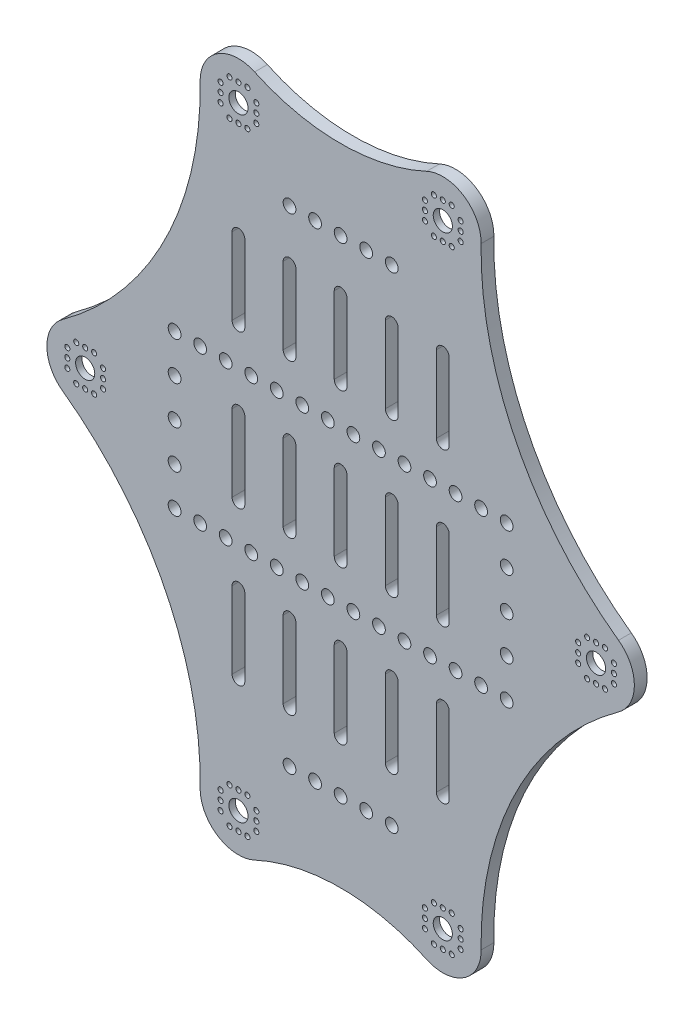
from build123d import *

# Parameters (mm, degrees)
BOSS_EXTRUDE1_DEPTH       = 5
SKETCH2_R                 = 11.25
CUT_EXTRUDE1_DEPTH        = 2.5
SKETCH3_R                 = 1
SKETCH3_R_2               = 3.75
CUT_EXTRUDE2_DEPTH        = 2.5
MIRROR2_COPY_1_SKETCH_R   = 1
MIRROR2_COPY_1_SKETCH_R_2 = 3.75
MIRROR2_COPY_1_DEPTH      = 2.5
SKETCH5_R                 = 2.5
CUT_EXTRUDE4_DEPTH        = 12.5
CUT_EXTRUDE6_DEPTH        = 10
SKETCH9_R                 = 2.5
CUT_EXTRUDE7_DEPTH        = 10
SKETCH10_R                = 2.5
CUT_EXTRUDE8_DEPTH        = 10


with BuildPart() as part:
    # Sketch1 → Boss-Extrude1 (new body)
    with BuildSketch(Plane.XY):
        with BuildLine():
            ThreePointArc((108.79085436, -12.15404787), (115, 0), (108.79085436, 12.15404787))
            ThreePointArc((108.79085436, 12.15404787), (68.702723984, 59.351361992), (54.997750912, 119.740254766))
            ThreePointArc((54.997750912, 119.740254766), (48.179588548, 132.573556823), (33.684210526, 133.60554311))
            ThreePointArc((33.684210526, 133.60554311), (0, 126.168439698), (-33.684210526, 133.60554311))
            ThreePointArc((-33.684210526, 133.60554311), (-48.179588548, 132.573556823), (-54.997750912, 119.740254766))
            ThreePointArc((-54.997750912, 119.740254766), (-68.702723984, 59.351361992), (-108.79085436, 12.15404787))
            ThreePointArc((-108.79085436, 12.15404787), (-115, 0), (-108.79085436, -12.15404787))
            ThreePointArc((-108.79085436, -12.15404787), (-68.702723984, -59.351361992), (-54.997750912, -119.740254766))
            ThreePointArc((-54.997750912, -119.740254766), (-48.179588548, -132.573556823), (-33.684210526, -133.60554311))
            ThreePointArc((-33.684210526, -133.60554311), (0, -126.168439698), (33.684210526, -133.60554311))
            ThreePointArc((33.684210526, -133.60554311), (48.179588548, -132.573556823), (54.997750912, -119.740254766))
            ThreePointArc((54.997750912, -119.740254766), (68.702723984, -59.351361992), (108.79085436, -12.15404787))
        make_face()
    extrude(amount=BOSS_EXTRUDE1_DEPTH)

    # Sketch2 → Cut-Extrude1 (cut)
    with BuildSketch(Plane(origin=(0, 0, 0), x_dir=(-1, 0, 0), z_dir=(0, 0, -1))):
        with Locations((-40, 120)):
            Circle(SKETCH2_R)
        with Locations((-100, 0)):
            Circle(SKETCH2_R)
        with Locations((100, 0)):
            Circle(SKETCH2_R)
        with Locations((40, 120)):
            Circle(SKETCH2_R)
        with Locations((40, -120)):
            Circle(SKETCH2_R)
        with Locations((-40, -120)):
            Circle(SKETCH2_R)
    extrude(amount=-CUT_EXTRUDE1_DEPTH, mode=Mode.SUBTRACT)

    # Sketch3 → Cut-Extrude2 (cut)
    with BuildSketch(Plane(origin=(0, 0, 2.5), x_dir=(-1, 0, 0), z_dir=(0, 0, -1))):
        with Locations((-47, 123.5)):
            Circle(SKETCH3_R)
        with Locations((-47, 120)):
            Circle(SKETCH3_R)
        with Locations((-47, 116.5)):
            Circle(SKETCH3_R)
        with Locations((-40, 120)):
            Circle(SKETCH3_R_2)
        with Locations((-43.5, 113)):
            Circle(SKETCH3_R)
        with Locations((-40, 113)):
            Circle(SKETCH3_R)
        with Locations((-36.5, 113)):
            Circle(SKETCH3_R)
        with Locations((-33, 116.5)):
            Circle(SKETCH3_R)
        with Locations((-33, 120)):
            Circle(SKETCH3_R)
        with Locations((-33, 123.5)):
            Circle(SKETCH3_R)
        with Locations((-36.5, 127)):
            Circle(SKETCH3_R)
        with Locations((-40, 127)):
            Circle(SKETCH3_R)
        with Locations((-43.5, 127)):
            Circle(SKETCH3_R)
        with Locations((-100, -7)):
            Circle(SKETCH3_R)
        with Locations((-100, 0)):
            Circle(SKETCH3_R_2)
        with Locations((-93, 0)):
            Circle(SKETCH3_R)
        with Locations((-100, 0)):
            Circle(SKETCH3_R_2)
        with Locations((-100, 0)):
            Circle(SKETCH3_R_2)
        with Locations((-107, -3.5)):
            Circle(SKETCH3_R)
        with Locations((-107, 0)):
            Circle(SKETCH3_R)
        with Locations((-107, 3.5)):
            Circle(SKETCH3_R)
        with Locations((-103.5, 7)):
            Circle(SKETCH3_R)
        with Locations((-100, 7)):
            Circle(SKETCH3_R)
        with Locations((-96.5, 7)):
            Circle(SKETCH3_R)
        with Locations((-96.5, -7)):
            Circle(SKETCH3_R)
        with Locations((-103.5, -7)):
            Circle(SKETCH3_R)
        with Locations((-93, -3.5)):
            Circle(SKETCH3_R)
        with Locations((-93, 3.5)):
            Circle(SKETCH3_R)
    cut_extrude2 = extrude(amount=-CUT_EXTRUDE2_DEPTH, mode=Mode.SUBTRACT)

    # Mirror1: Cut-Extrude2 across plane
    add(cut_extrude2.mirror(Plane(origin=(0, 0, 0), x_dir=(0, 0, 1), z_dir=(1, 0, 0))), mode=Mode.SUBTRACT)

    # Mirror2: Cut-Extrude2 across plane
    add(cut_extrude2.mirror(Plane.ZX), mode=Mode.SUBTRACT)

    # Mirror2 copy 1 sketch → Mirror2 copy 1 (cut)
    with BuildSketch(Plane(origin=(0, 0, 2.5), x_dir=(1, 0, 0), z_dir=(0, 0, -1))):
        with Locations((-47, 123.5)):
            Circle(MIRROR2_COPY_1_SKETCH_R)
        with Locations((-47, 120)):
            Circle(MIRROR2_COPY_1_SKETCH_R)
        with Locations((-47, 116.5)):
            Circle(MIRROR2_COPY_1_SKETCH_R)
        with Locations((-40, 120)):
            Circle(MIRROR2_COPY_1_SKETCH_R_2)
        with Locations((-43.5, 113)):
            Circle(MIRROR2_COPY_1_SKETCH_R)
        with Locations((-40, 113)):
            Circle(MIRROR2_COPY_1_SKETCH_R)
        with Locations((-36.5, 113)):
            Circle(MIRROR2_COPY_1_SKETCH_R)
        with Locations((-33, 116.5)):
            Circle(MIRROR2_COPY_1_SKETCH_R)
        with Locations((-33, 120)):
            Circle(MIRROR2_COPY_1_SKETCH_R)
        with Locations((-33, 123.5)):
            Circle(MIRROR2_COPY_1_SKETCH_R)
        with Locations((-36.5, 127)):
            Circle(MIRROR2_COPY_1_SKETCH_R)
        with Locations((-40, 127)):
            Circle(MIRROR2_COPY_1_SKETCH_R)
        with Locations((-43.5, 127)):
            Circle(MIRROR2_COPY_1_SKETCH_R)
        with Locations((-100, -7)):
            Circle(MIRROR2_COPY_1_SKETCH_R)
        with Locations((-100, 0)):
            Circle(MIRROR2_COPY_1_SKETCH_R_2)
        with Locations((-93, 0)):
            Circle(MIRROR2_COPY_1_SKETCH_R)
        with Locations((-100, 0)):
            Circle(MIRROR2_COPY_1_SKETCH_R_2)
        with Locations((-100, 0)):
            Circle(MIRROR2_COPY_1_SKETCH_R_2)
        with Locations((-107, -3.5)):
            Circle(MIRROR2_COPY_1_SKETCH_R)
        with Locations((-107, 0)):
            Circle(MIRROR2_COPY_1_SKETCH_R)
        with Locations((-107, 3.5)):
            Circle(MIRROR2_COPY_1_SKETCH_R)
        with Locations((-103.5, 7)):
            Circle(MIRROR2_COPY_1_SKETCH_R)
        with Locations((-100, 7)):
            Circle(MIRROR2_COPY_1_SKETCH_R)
        with Locations((-96.5, 7)):
            Circle(MIRROR2_COPY_1_SKETCH_R)
        with Locations((-96.5, -7)):
            Circle(MIRROR2_COPY_1_SKETCH_R)
        with Locations((-103.5, -7)):
            Circle(MIRROR2_COPY_1_SKETCH_R)
        with Locations((-93, -3.5)):
            Circle(MIRROR2_COPY_1_SKETCH_R)
        with Locations((-93, 3.5)):
            Circle(MIRROR2_COPY_1_SKETCH_R)
    extrude(amount=-MIRROR2_COPY_1_DEPTH, mode=Mode.SUBTRACT)

    # Sketch5 → Cut-Extrude4 (cut)
    with BuildSketch(Plane(origin=(0, 0, 0), x_dir=(-1, 0, 0), z_dir=(0, 0, -1))):
        with Locations((20, 95)):
            Circle(SKETCH5_R)
        with Locations((0, 95)):
            Circle(SKETCH5_R)
        with Locations((10, 95)):
            Circle(SKETCH5_R)
        with Locations((10, -95)):
            Circle(SKETCH5_R)
        with Locations((0, -95)):
            Circle(SKETCH5_R)
        with Locations((20, -95)):
            Circle(SKETCH5_R)
        with Locations((-20, 95)):
            Circle(SKETCH5_R)
        with Locations((-10, 95)):
            Circle(SKETCH5_R)
        with Locations((-20, -95)):
            Circle(SKETCH5_R)
        with Locations((-10, -95)):
            Circle(SKETCH5_R)
    extrude(amount=-CUT_EXTRUDE4_DEPTH, mode=Mode.SUBTRACT)

    # Sketch8 → Cut-Extrude6 (cut)
    with BuildSketch(Plane.XY.offset(5)):
        with BuildLine():
            Line((42.5, 75), (42.5, 45))
            ThreePointArc((42.5, 45), (40, 42.5), (37.5, 45))
            Line((37.5, 45), (37.5, 75))
            ThreePointArc((37.5, 75), (40, 77.5), (42.5, 75))
        make_face()
        with BuildLine():
            Line((22.5, 75), (22.5, 45))
            ThreePointArc((22.5, 45), (20, 42.5), (17.5, 45))
            Line((17.5, 45), (17.5, 75))
            ThreePointArc((17.5, 75), (20, 77.5), (22.5, 75))
        make_face()
        with BuildLine():
            Line((2.5, 75), (2.5, 45))
            ThreePointArc((2.5, 45), (0, 42.5), (-2.5, 45))
            Line((-2.5, 45), (-2.5, 75))
            ThreePointArc((-2.5, 75), (0, 77.5), (2.5, 75))
        make_face()
        with BuildLine():
            Line((-17.5, 75), (-17.5, 45))
            ThreePointArc((-17.5, 45), (-20, 42.5), (-22.5, 45))
            Line((-22.5, 45), (-22.5, 75))
            ThreePointArc((-22.5, 75), (-20, 77.5), (-17.5, 75))
        make_face()
        with BuildLine():
            Line((-37.5, 75), (-37.5, 45))
            ThreePointArc((-37.5, 45), (-40, 42.5), (-42.5, 45))
            Line((-42.5, 45), (-42.5, 75))
            ThreePointArc((-42.5, 75), (-40, 77.5), (-37.5, 75))
        make_face()
        with BuildLine():
            Line((42.5, 15), (42.5, -15))
            ThreePointArc((42.5, -15), (40, -17.5), (37.5, -15))
            Line((37.5, -15), (37.5, 15))
            ThreePointArc((37.5, 15), (40, 17.5), (42.5, 15))
        make_face()
        with BuildLine():
            Line((22.5, 15), (22.5, -15))
            ThreePointArc((22.5, -15), (20, -17.5), (17.5, -15))
            Line((17.5, -15), (17.5, 15))
            ThreePointArc((17.5, 15), (20, 17.5), (22.5, 15))
        make_face()
        with BuildLine():
            Line((2.5, 15), (2.5, -15))
            ThreePointArc((2.5, -15), (0, -17.5), (-2.5, -15))
            Line((-2.5, -15), (-2.5, 15))
            ThreePointArc((-2.5, 15), (0, 17.5), (2.5, 15))
        make_face()
        with BuildLine():
            Line((-17.5, 15), (-17.5, -15))
            ThreePointArc((-17.5, -15), (-20, -17.5), (-22.5, -15))
            Line((-22.5, -15), (-22.5, 15))
            ThreePointArc((-22.5, 15), (-20, 17.5), (-17.5, 15))
        make_face()
        with BuildLine():
            Line((-37.5, 15), (-37.5, -15))
            ThreePointArc((-37.5, -15), (-40, -17.5), (-42.5, -15))
            Line((-42.5, -15), (-42.5, 15))
            ThreePointArc((-42.5, 15), (-40, 17.5), (-37.5, 15))
        make_face()
        with BuildLine():
            Line((42.5, -45), (42.5, -75))
            ThreePointArc((42.5, -75), (40, -77.5), (37.5, -75))
            Line((37.5, -75), (37.5, -45))
            ThreePointArc((37.5, -45), (40, -42.5), (42.5, -45))
        make_face()
        with BuildLine():
            Line((22.5, -45), (22.5, -75))
            ThreePointArc((22.5, -75), (20, -77.5), (17.5, -75))
            Line((17.5, -75), (17.5, -45))
            ThreePointArc((17.5, -45), (20, -42.5), (22.5, -45))
        make_face()
        with BuildLine():
            Line((2.5, -45), (2.5, -75))
            ThreePointArc((2.5, -75), (0, -77.5), (-2.5, -75))
            Line((-2.5, -75), (-2.5, -45))
            ThreePointArc((-2.5, -45), (0, -42.5), (2.5, -45))
        make_face()
        with BuildLine():
            Line((-17.5, -45), (-17.5, -75))
            ThreePointArc((-17.5, -75), (-20, -77.5), (-22.5, -75))
            Line((-22.5, -75), (-22.5, -45))
            ThreePointArc((-22.5, -45), (-20, -42.5), (-17.5, -45))
        make_face()
        with BuildLine():
            Line((-37.5, -45), (-37.5, -75))
            ThreePointArc((-37.5, -75), (-40, -77.5), (-42.5, -75))
            Line((-42.5, -75), (-42.5, -45))
            ThreePointArc((-42.5, -45), (-40, -42.5), (-37.5, -45))
        make_face()
    extrude(amount=-CUT_EXTRUDE6_DEPTH, mode=Mode.SUBTRACT)

    # Sketch9 → Cut-Extrude7 (cut)
    with BuildSketch(Plane.XY.offset(5)):
        with Locations((-65, 30)):
            Circle(SKETCH9_R)
        with Locations((-55, 30)):
            Circle(SKETCH9_R)
        with Locations((-45, 30)):
            Circle(SKETCH9_R)
        with Locations((-35, 30)):
            Circle(SKETCH9_R)
        with Locations((-25, 30)):
            Circle(SKETCH9_R)
        with Locations((-15, 30)):
            Circle(SKETCH9_R)
        with Locations((-5, 30)):
            Circle(SKETCH9_R)
        with Locations((5, 30)):
            Circle(SKETCH9_R)
        with Locations((15, 30)):
            Circle(SKETCH9_R)
        with Locations((25, 30)):
            Circle(SKETCH9_R)
        with Locations((35, 30)):
            Circle(SKETCH9_R)
        with Locations((45, 30)):
            Circle(SKETCH9_R)
        with Locations((55, 30)):
            Circle(SKETCH9_R)
        with Locations((65, 30)):
            Circle(SKETCH9_R)
        with Locations((65, -30)):
            Circle(SKETCH9_R)
        with Locations((55, -30)):
            Circle(SKETCH9_R)
        with Locations((45, -30)):
            Circle(SKETCH9_R)
        with Locations((35, -30)):
            Circle(SKETCH9_R)
        with Locations((25, -30)):
            Circle(SKETCH9_R)
        with Locations((15, -30)):
            Circle(SKETCH9_R)
        with Locations((5, -30)):
            Circle(SKETCH9_R)
        with Locations((-5, -30)):
            Circle(SKETCH9_R)
        with Locations((-15, -30)):
            Circle(SKETCH9_R)
        with Locations((-25, -30)):
            Circle(SKETCH9_R)
        with Locations((-35, -30)):
            Circle(SKETCH9_R)
        with Locations((-45, -30)):
            Circle(SKETCH9_R)
        with Locations((-55, -30)):
            Circle(SKETCH9_R)
        with Locations((-65, -30)):
            Circle(SKETCH9_R)
    extrude(amount=-CUT_EXTRUDE7_DEPTH, mode=Mode.SUBTRACT)

    # Sketch10 → Cut-Extrude8 (cut)
    with BuildSketch(Plane.XY.offset(5)):
        with Locations((-65, 0)):
            Circle(SKETCH10_R)
        with Locations((-65, 15)):
            Circle(SKETCH10_R)
        with Locations((-65, -15)):
            Circle(SKETCH10_R)
        with Locations((65, -15)):
            Circle(SKETCH10_R)
        with Locations((65, 0)):
            Circle(SKETCH10_R)
        with Locations((65, 15)):
            Circle(SKETCH10_R)
    extrude(amount=-CUT_EXTRUDE8_DEPTH, mode=Mode.SUBTRACT)


solid = part.part
